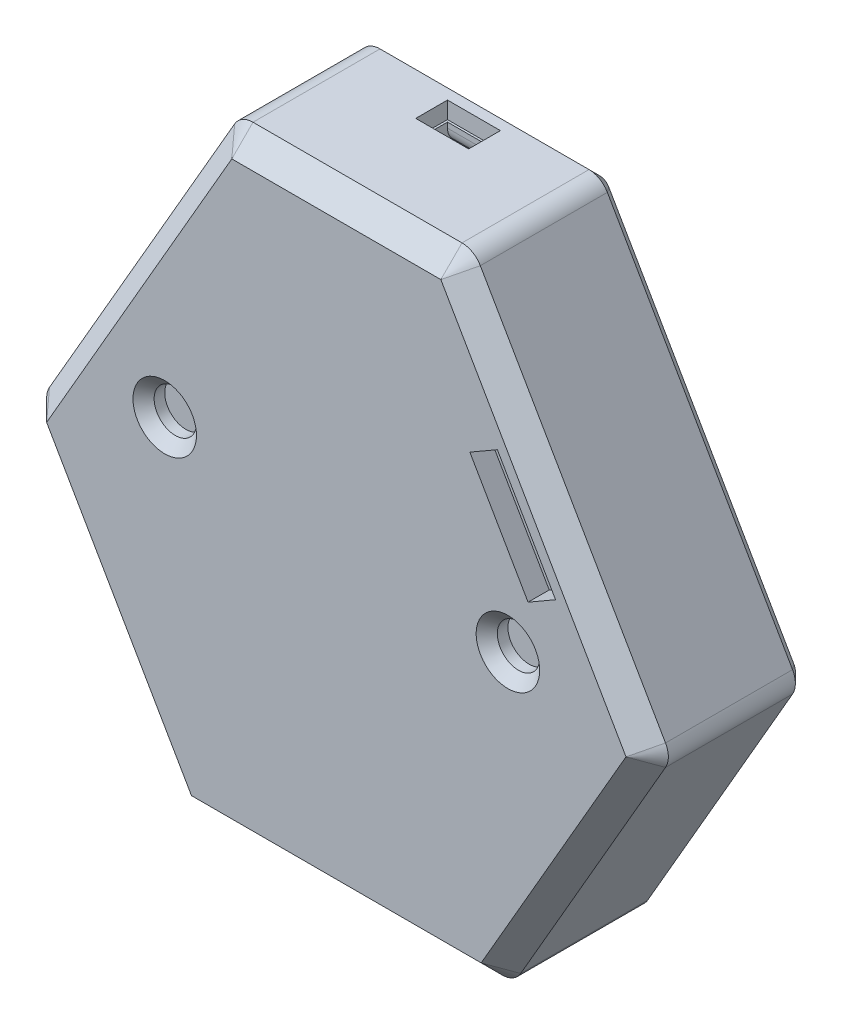
from build123d import *

# Parameters (mm, degrees)
BOSS_EXTRUDE1_DEPTH     = 6
BOSS_EXTRUDE2_DEPTH     = 7
CUT_EXTRUDE1_DEPTH      = 42.723654362
CUT_EXTRUDE1_DEPTH_BACK = 3
BOSS_EXTRUDE3_DEPTH     = 2
CHAMFER2_SIZE           = 2
BOSS_EXTRUDE4_DEPTH     = 8.5
BOSS_EXTRUDE5_DEPTH     = 13
BOSS_EXTRUDE6_DEPTH     = 2
SKETCH10_R              = 2
CUT_EXTRUDE2_DEPTH      = 47.356696747
FILLET2_R               = 2
CHAMFER3_SIZE           = 2
CHAMFER4_SIZE           = 1
CHAMFER5_SIZE           = 1
CUT_EXTRUDE3_START      = -10.5
SKETCH12_W              = 5
SKETCH12_H              = 3
CUT_EXTRUDE3_DEPTH      = 10.5
SKETCH13_W              = 5
SKETCH13_H              = 3
CUT_EXTRUDE4_DEPTH      = 3.8
SKETCH14_W              = 5
SKETCH14_H              = 3
CUT_EXTRUDE5_DEPTH      = 2
FILLET4_R               = 1.5


with BuildPart() as part:
    # Sketch1 → Boss-Extrude1 (new body)
    with BuildSketch(Plane.XY):
        Polygon((9.988159657, 30.5), (14.145081595, 23.3), (27.597342867, 0), (13.798671434, -23.9), (-13.798671434, -23.9), (-27.597342867, 0), (-14.145081595, 23.3), (-9.988159657, 30.5), align=None)
        Polygon((13.105851111, -22.7), (26.211702221, 0), (13.105851111, 22.7), (9.295339334, 29.3), (-9.295339334, 29.3), (-13.105851111, 22.7), (-26.211702221, 0), (-13.105851111, -22.7), align=None, mode=Mode.SUBTRACT)
    extrude(amount=BOSS_EXTRUDE1_DEPTH)

    # Sketch2 → Boss-Extrude2 (add)
    # profile 1 of 3: a face of its own
    with BuildSketch(Plane(origin=(0, 0, 0), x_dir=(-1, 0, 0), z_dir=(0, 0, -1))):
        Polygon((27.597342867, 0), (9.988159657, 30.5), (-9.988159657, 30.5), (-27.597342867, 0), (-13.798671434, -23.9), (13.798671434, -23.9), align=None)
        Polygon((-13.105851111, -22.7), (-26.211702221, 0), (-9.295339334, 29.3), (9.295339334, 29.3), (26.211702221, 0), (13.105851111, -22.7), align=None, mode=Mode.SUBTRACT)
    # profile 2 of 3: a face of its own
    with BuildSketch(Plane(origin=(0, 0, 0), x_dir=(-1, 0, 0), z_dir=(0, 0, -1))):
        Polygon((-15.5, -18.553212483), (-15.5, 18.553212483), (-26.211702221, 0), align=None)
    # profile 3 of 3: a face of its own
    with BuildSketch(Plane(origin=(0, 0, 0), x_dir=(-1, 0, 0), z_dir=(0, 0, -1))):
        Polygon((26.211702221, 0), (15.5, 18.553212483), (15.5, -18.553212483), align=None)
    extrude(amount=BOSS_EXTRUDE2_DEPTH)

    # Sketch4 → Cut-Extrude1 (cut, two sides: drawn at the far end of the back side and taken through both)
    with BuildSketch(Plane.XY.offset(-CUT_EXTRUDE1_DEPTH_BACK)):
        Polygon((15.5, 0), (26.211702221, 0), (15.5, 18.553212483), align=None)
    extrude(amount=CUT_EXTRUDE1_DEPTH + CUT_EXTRUDE1_DEPTH_BACK, mode=Mode.SUBTRACT)

    # Sketch6 → Boss-Extrude3 (add)
    with BuildSketch(Plane(origin=(0, 0, -7), x_dir=(-1, 0, 0), z_dir=(0, 0, -1))):
        Polygon((-27.597342867, 0), (-13.798671434, -23.9), (13.798671434, -23.9), (27.597342867, 0), (9.988159657, 30.5), (-9.988159657, 30.5), align=None)
    extrude(amount=BOSS_EXTRUDE3_DEPTH)

    # Chamfer2
    chamfer2_edges = [part.edges().sort_by_distance(p)[0] for p in [
        (18.792751262, 15.25, -9),
        (20.69800715, -11.95, -9),
        (0, -23.9, -9),
        (-20.69800715, -11.95, -9),
        (-18.792751262, 15.25, -9),
        (0, 30.5, -9),
    ]]
    chamfer(chamfer2_edges, length=CHAMFER2_SIZE)

    # Sketch7 → Boss-Extrude4 (add)
    with BuildSketch(Plane.XY.offset(-7)):
        Polygon((-10.450039872, 27.3), (10.450039872, 27.3), (9.295339334, 29.3), (-9.295339334, 29.3), align=None)
    extrude(amount=BOSS_EXTRUDE4_DEPTH)

    # Chamfer5
    chamfer5_edges = [part.edges().sort_by_distance(p)[0] for p in [
        (0, 27.3, -7),
        (0, -22.7, -7),
    ]]
    chamfer(chamfer5_edges, length=CHAMFER5_SIZE)

    # Sketch12 → Cut-Extrude3 (cut)
    with BuildSketch(Plane(origin=(0, 0, -9), x_dir=(-1, 0, 0), z_dir=(0, 0, -1)).offset(CUT_EXTRUDE3_START)):
        with Locations((0, 27)):
            Rectangle(SKETCH12_W, SKETCH12_H)
    extrude(amount=CUT_EXTRUDE3_DEPTH, mode=Mode.SUBTRACT)

    # Sketch14 → Cut-Extrude5 (cut)
    with BuildSketch(Plane(origin=(0, 30.5, 0), x_dir=(1, 0, 0), z_dir=(0, 1, 0))):
        with Locations((0, 3.5)):
            Rectangle(SKETCH14_W, SKETCH14_H)
    extrude(amount=-CUT_EXTRUDE5_DEPTH, mode=Mode.SUBTRACT)

    # Fillet4
    fillet4_edges = [part.edges().sort_by_distance(p)[0] for p in [
        (0, 28.5, -5),
    ]]
    fillet(fillet4_edges, radius=FILLET4_R)


with BuildPart() as body_2:
    # Sketch8 → Boss-Extrude5 (new body)
    with BuildSketch(Plane.XY.offset(6)):
        Polygon((14.837901918, -25.7), (29.675803836, 0), (11.027390142, 32.3), (-11.027390142, 32.3), (-29.675803836, 0), (-14.837901918, -25.7), align=None)
        Polygon((27.828282975, 0), (10.103629711, 30.7), (-10.103629711, 30.7), (-27.828282975, 0), (-13.914141487, -24.1), (13.914141487, -24.1), align=None, mode=Mode.SUBTRACT)
    extrude(amount=-BOSS_EXTRUDE5_DEPTH)

    # Sketch9 → Boss-Extrude6 (add)
    with BuildSketch(Plane.XY.offset(6)):
        Polygon((-29.675803836, 0), (-14.837901918, -25.7), (14.837901918, -25.7), (29.675803836, 0), (11.027390142, 32.3), (-11.027390142, 32.3), align=None)
    extrude(amount=BOSS_EXTRUDE6_DEPTH)

    # Sketch10 → Cut-Extrude2 (cut, through all)
    with BuildSketch(Plane.XY.offset(6)):
        with Locations((-16.211702221, 6)):
            Circle(SKETCH10_R)
        with Locations((16.211702221, 3)):
            Circle(SKETCH10_R)
        Polygon((18.11362601, 8.026279442), (20.711702221, 9.526279442), (15.211702221, 19.052558883), (12.61362601, 17.552558883), align=None)
    extrude(amount=CUT_EXTRUDE2_DEPTH, mode=Mode.SUBTRACT)

    # Fillet2
    fillet2_edges = [body_2.edges().sort_by_distance(p)[0] for p in [
        (14.837901918, -25.7, 0.5),
        (-14.837901918, -25.7, 0.5),
        (-29.675803836, 0, 0.5),
        (-11.027390142, 32.3, 0.5),
        (11.027390142, 32.3, 0.5),
        (29.675803836, 0, 0.5),
    ]]
    fillet(fillet2_edges, radius=FILLET2_R)

    # Chamfer3
    chamfer3_edges = [body_2.edges().sort_by_distance(p)[0] for p in [
        (22.256852877, -12.85, 8),
        (-20.351596989, 16.15, 8),
        (-22.256852877, -12.85, 8),
        (0, -25.7, 8),
        (20.351596989, 16.15, 8),
        (0, 32.3, 8),
        (14.68320138, -25.432050808, 8),
        (-14.68320138, -25.432050808, 8),
        (-29.36640276, 0, 8),
        (-10.872689603, 32.032050808, 8),
        (10.872689603, 32.032050808, 8),
        (29.36640276, 0, 8),
    ]]
    chamfer(chamfer3_edges, length=CHAMFER3_SIZE)

    # Chamfer4
    chamfer4_edges = [body_2.edges().sort_by_distance(p)[0] for p in [
        (-18.211702221, 6, 8),
        (14.211702221, 3, 8),
        (22.256852877, -12.85, -7),
        (20.351596989, 16.15, -7),
        (0, -25.7, -7),
        (-22.256852877, -12.85, -7),
        (-20.351596989, 16.15, -7),
        (0, 32.3, -7),
        (14.68320138, -25.432050808, -7),
        (-14.68320138, -25.432050808, -7),
        (-29.36640276, 0, -7),
        (-10.872689603, 32.032050808, -7),
        (10.872689603, 32.032050808, -7),
        (29.36640276, 0, -7),
    ]]
    chamfer(chamfer4_edges, length=CHAMFER4_SIZE)

    # Sketch13 → Cut-Extrude4 (cut)
    with BuildSketch(Plane(origin=(0, 32.3, 0), x_dir=(1, 0, 0), z_dir=(0, 1, 0))):
        with Locations((0, 3.5)):
            Rectangle(SKETCH13_W, SKETCH13_H)
    extrude(amount=-CUT_EXTRUDE4_DEPTH, mode=Mode.SUBTRACT)


solid = Compound([part.part, body_2.part])
